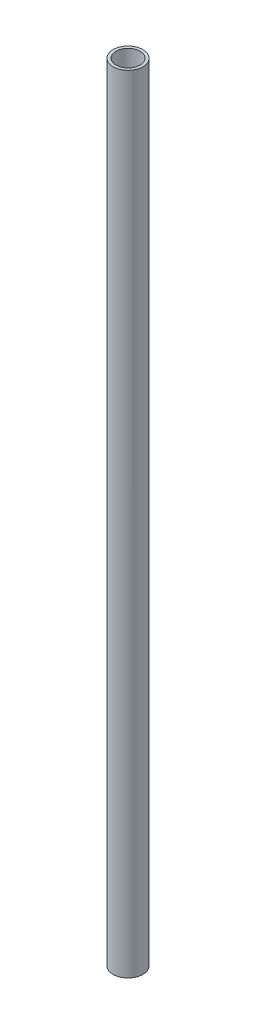
from build123d import *

# Parameters (mm, degrees)
SKETCH1_R           = 0.3977
SKETCH1_R_2         = 0.3215
BOSS_EXTRUDE1_DEPTH = 21


with BuildPart() as part:
    # Sketch1 → Boss-Extrude1 (new body)
    with BuildSketch(Plane(origin=(0, 0, 0), x_dir=(1, 0, 0), z_dir=(0, 1, 0))):
        with Locations(Location((0, 0, 0), (0, 0, 90))):
            Circle(SKETCH1_R)
        with Locations(Location((0, 0, 0), (0, 0, 90))):
            Circle(SKETCH1_R_2, mode=Mode.SUBTRACT)
    extrude(amount=BOSS_EXTRUDE1_DEPTH)


solid = part.part
